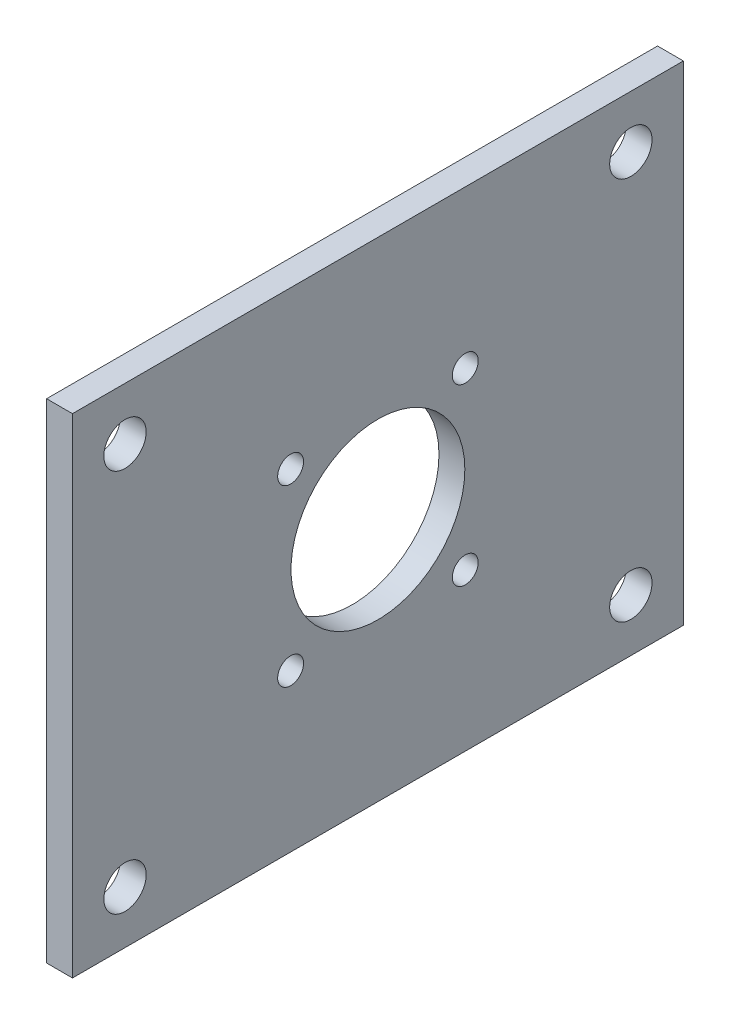
from build123d import *

# Parameters (mm, degrees)
BOSS_EXTRUDE1_DEPTH      = 1.5875
BOSS_EXTRUDE1_DEPTH_BACK = 1.5875
SKETCH1_W                = 75
SKETCH1_H                = 60
CUT_EXTRUDE1_DEPTH       = 49.049663435
CUT_EXTRUDE1_DEPTH_BACK  = 49.049663435
SKETCH2_R                = 2.6
CUT_EXTRUDE2_DEPTH       = 49.049663435
CUT_EXTRUDE2_DEPTH_BACK  = 49.049663435
SKETCH3_R                = 10.67
SKETCH3_R_2              = 1.59


with BuildPart() as part:
    # Sketch1 → Boss-Extrude1 (new, two sides: drawn at the far end of the back side and taken through both)
    with BuildSketch(Plane(origin=(0, 0, 0), x_dir=(0, 0, -1), z_dir=(1, 0, 0)).offset(-BOSS_EXTRUDE1_DEPTH_BACK)):
        Rectangle(SKETCH1_W, SKETCH1_H)
    extrude(amount=BOSS_EXTRUDE1_DEPTH + BOSS_EXTRUDE1_DEPTH_BACK)

    # Sketch2 → Cut-Extrude1 (cut, two sides: drawn at the far end of the back side and taken through both)
    with BuildSketch(Plane(origin=(0, 0, 0), x_dir=(0, 0, -1), z_dir=(1, 0, 0)).offset(-CUT_EXTRUDE1_DEPTH_BACK)):
        with Locations((-31.05, 23.55)):
            Circle(SKETCH2_R)
        with Locations((31.05, 23.55)):
            Circle(SKETCH2_R)
        with Locations((31.05, -23.55)):
            Circle(SKETCH2_R)
        with Locations((-31.05, -23.55)):
            Circle(SKETCH2_R)
    extrude(amount=CUT_EXTRUDE1_DEPTH + CUT_EXTRUDE1_DEPTH_BACK, mode=Mode.SUBTRACT)

    # Sketch3 → Cut-Extrude2 (cut, two sides: drawn at the far end of the back side and taken through both)
    with BuildSketch(Plane(origin=(0, 0, 0), x_dir=(0, 0, -1), z_dir=(1, 0, 0)).offset(-CUT_EXTRUDE2_DEPTH_BACK)):
        Circle(SKETCH3_R)
        with Locations((-10.72, 10.72)):
            Circle(SKETCH3_R_2)
        with Locations((10.72, 10.72)):
            Circle(SKETCH3_R_2)
        with Locations((10.72, -10.72)):
            Circle(SKETCH3_R_2)
        with Locations((-10.72, -10.72)):
            Circle(SKETCH3_R_2)
    extrude(amount=CUT_EXTRUDE2_DEPTH + CUT_EXTRUDE2_DEPTH_BACK, mode=Mode.SUBTRACT)


solid = part.part
